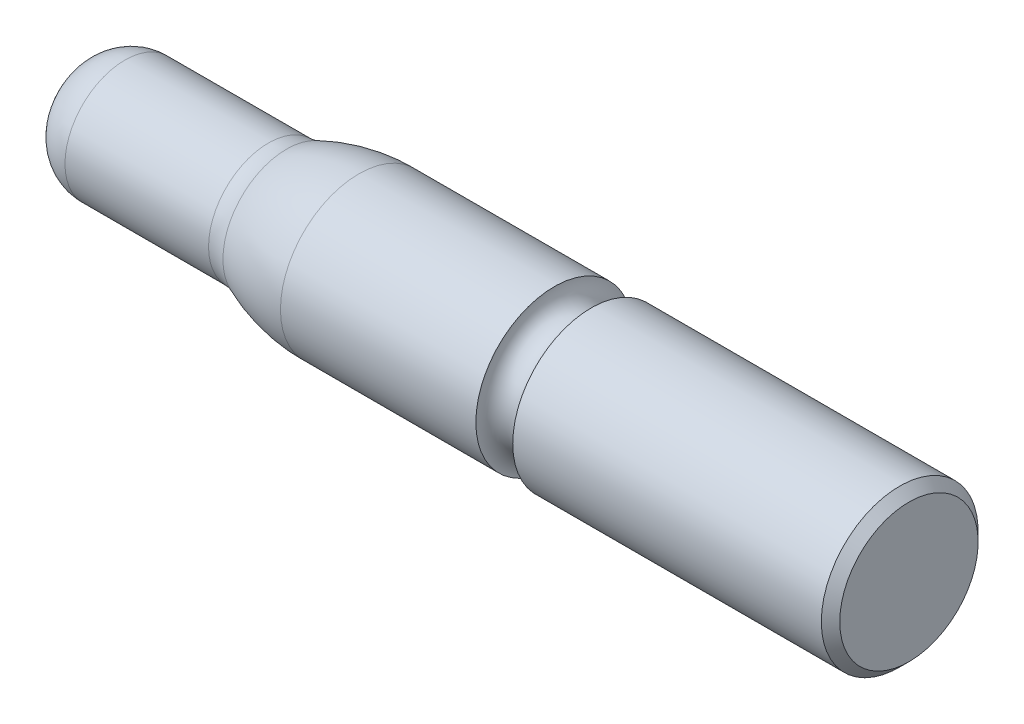
from build123d import *

# Parameters (mm, degrees)
FILLET1_R     = 10
CHAMFER1_SIZE = 2


with BuildPart() as part:
    # Sketch1 → Revolve1 (revolve)
    with BuildSketch(Plane.XY, mode=Mode.PRIVATE) as revolve1_sk:
        with BuildLine():
            Line((0, 0), (71.656242166, 0))
            ThreePointArc((71.656242166, 0), (75.656242166, 4), (79.656242166, 0))
            Line((79.656242166, 0), (148.568475549, 0))
            Line((148.568475549, 0), (148.568475549, 17))
            Line((148.568475549, 17), (79.656242166, 17))
            ThreePointArc((79.656242166, 17), (75.656242166, 13), (71.656242166, 17))
            Line((71.656242166, 17), (29.293635646, 17))
            ThreePointArc((29.293635646, 17), (20.349363736, 15.987177379), (11.858039872, 13))
            Line((11.858039872, 13), (-31.431524451, 13))
            Line((-31.431524451, 13), (-31.431524451, 0))
            Line((-31.431524451, 0), (0, 0))
        make_face()
    revolve(revolve1_sk.sketch.rotate(Axis((0, 0, 0), (1, 0, 0)), 90), axis=Axis((0, 0, 0), (1, 0, 0)))

    # Fillet1
    fillet1_edges = [part.edges().sort_by_distance(p)[0] for p in [
        (11.858039872, 0, -13),
        (-31.431524451, 0, -13),
    ]]
    fillet(fillet1_edges, radius=FILLET1_R)

    # Chamfer1
    chamfer1_edges = [part.edges().sort_by_distance(p)[0] for p in [
        (148.568475549, 0, -17),
    ]]
    chamfer(chamfer1_edges, length=CHAMFER1_SIZE)


solid = part.part
